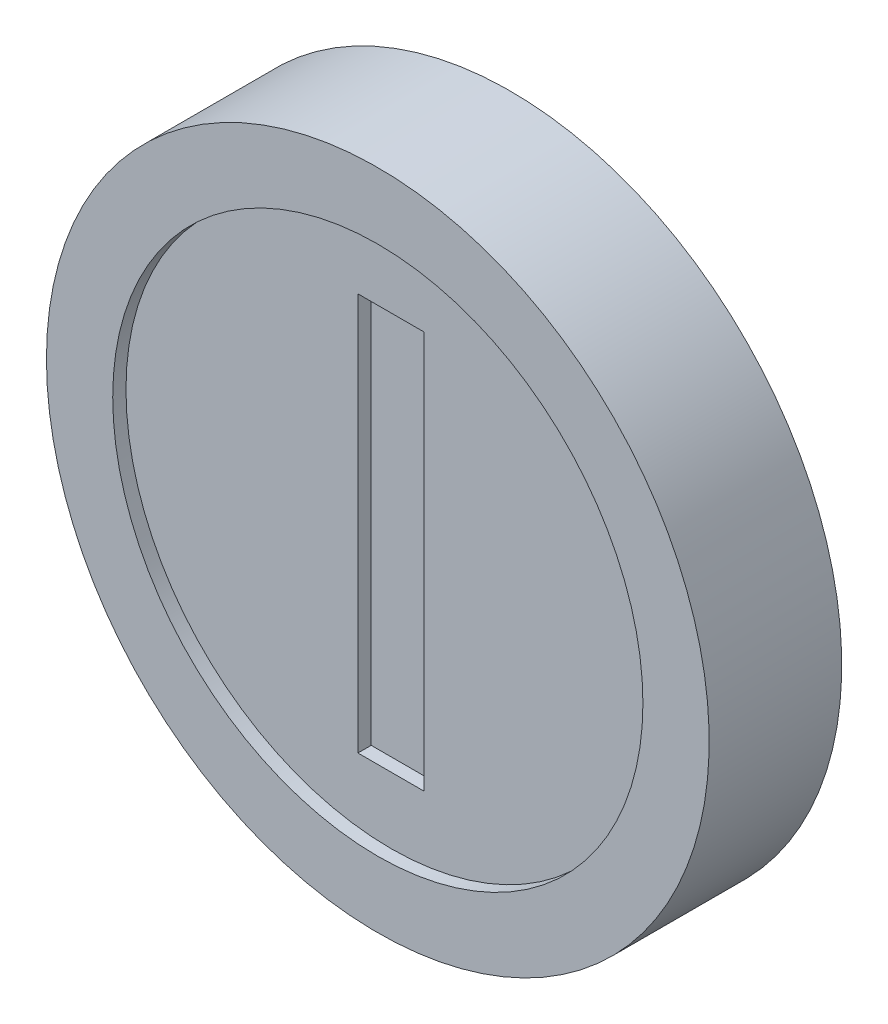
from build123d import *

# Parameters (mm, degrees)
SKETCH2_W          = 25.4
SKETCH2_H          = 10.16
SKETCH3_W          = 6.35
SKETCH3_H          = 38.1
CUT_EXTRUDE1_DEPTH = 1.27


with BuildPart() as part:
    # Sketch2 → Revolve1 (revolve)
    with BuildSketch(Plane(origin=(0, 0, 0), x_dir=(1, 0, 0), z_dir=(0, 1, 0)), mode=Mode.PRIVATE) as revolve1_sk:
        with Locations((12.7, 0)):
            Rectangle(SKETCH2_W, SKETCH2_H)
        Polygon((25.4, 5.08), (25.4, -5.08), (25.4, -6.35), (31.75, -6.35), (31.75, 6.35), (25.4, 6.35), align=None)
    revolve(revolve1_sk.sketch.rotate(Axis((0, 0, -88.99), (0, 0, 1)), 180), axis=Axis((0, 0, -88.99), (0, 0, 1)))

    # Sketch3 → Cut-Extrude1 (cut)
    with BuildSketch(Plane.XY.offset(5.08)):
        Rectangle(SKETCH3_W, SKETCH3_H)
    cut_extrude1 = extrude(amount=-CUT_EXTRUDE1_DEPTH, mode=Mode.SUBTRACT)

    # Mirror1: Cut-Extrude1 across plane
    add(cut_extrude1.mirror(Plane.XY), mode=Mode.SUBTRACT)


solid = part.part
